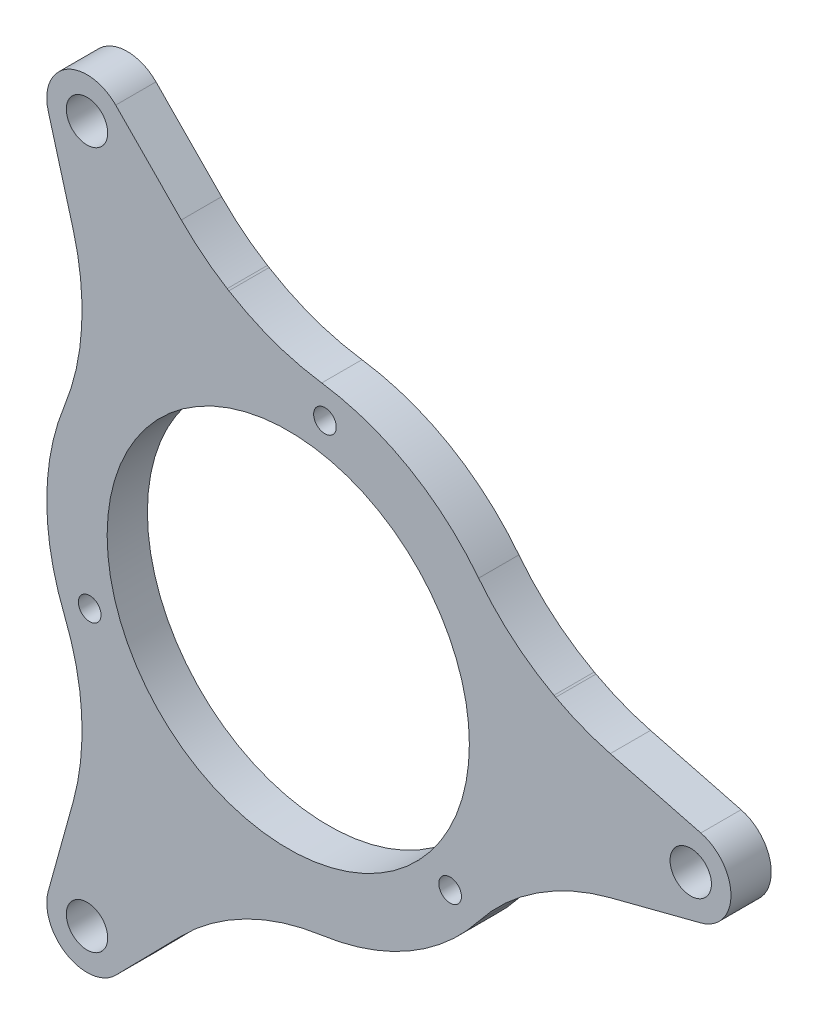
from build123d import *
from build123d.topology import SkipClean

# Parameters (mm, degrees)
BOSS_EXTRUDE1_DEPTH      = 6.35
BOSS_EXTRUDE1_DEPTH_BACK = 6.35
BOSS_EXTRUDE2_START      = -12.7
BOSS_EXTRUDE2_DEPTH      = 12.7
SKETCH4_R                = 28.575
CUT_EXTRUDE1_DEPTH       = 61.157662646
SKETCH5_R                = 28.575
BOSS_EXTRUDE3_DEPTH      = 6.35
F_0_257_DIAMETER_HOLE1_D = 6.5278
CUT_EXTRUDE2_DEPTH       = 94.825678832
CUT_EXTRUDE2_DEPTH_BACK  = 94.825678832
SKETCH8_W                = 12.7
SKETCH8_H                = 88.9
FILLET3_R                = 38.1
SKETCH10_R               = 1.786001
CUT_EXTRUDE4_DEPTH       = 94.17880933


with BuildPart() as part:
    # Sketch1 → Boss-Extrude1 (new, two sides: drawn at the far end of the back side and taken through both)
    with BuildSketch(Plane.XY.offset(-BOSS_EXTRUDE1_DEPTH_BACK)):
        with BuildLine():
            Line((27.49630657, 15.875), (38.494829198, 22.225))
            ThreePointArc((38.494829198, 22.225), (19.878280804, 29.537115412), (0, 31.75))
            Line((0, 31.75), (0, 44.45))
            ThreePointArc((0, 44.45), (-15.640751899, 31.983653865), (-27.49630657, 15.875))
            Line((-27.49630657, 15.875), (-38.494829198, 22.225))
            ThreePointArc((-38.494829198, 22.225), (-35.519032703, 2.446538454), (-27.49630657, -15.875))
            Line((-27.49630657, -15.875), (-38.494829198, -22.225))
            ThreePointArc((-38.494829198, -22.225), (-19.878280804, -29.537115412), (0, -31.75))
            Line((0, -31.75), (0, -44.45))
            ThreePointArc((0, -44.45), (15.640751899, -31.983653865), (27.49630657, -15.875))
            Line((27.49630657, -15.875), (38.494829198, -22.225))
            ThreePointArc((38.494829198, -22.225), (35.519032703, -2.446538454), (27.49630657, 15.875))
        make_face()
        with BuildLine():
            ThreePointArc((-11.129967969, 17.779280801), (-16.817028225, 8.924127912), (-20.962292819, -0.749194604))
            ThreePointArc((-20.962292819, -0.749194604), (-16.137035591, -10.101909703), (-9.83232485, -18.528475405))
            ThreePointArc((-9.83232485, -18.528475405), (0.679992634, -19.026037615), (11.129967969, -17.779280801))
            ThreePointArc((11.129967969, -17.779280801), (16.817028225, -8.924127912), (20.962292819, 0.749194604))
            ThreePointArc((20.962292819, 0.749194604), (16.137035591, 10.101909703), (9.83232485, 18.528475405))
            ThreePointArc((9.83232485, 18.528475405), (-0.679992634, 19.026037615), (-11.129967969, 17.779280801))
        make_face(mode=Mode.SUBTRACT)
    extrude(amount=BOSS_EXTRUDE1_DEPTH + BOSS_EXTRUDE1_DEPTH_BACK)

    # Sketch3 → Boss-Extrude2 (add)
    with BuildSketch(Plane.XY.offset(6.35).offset(BOSS_EXTRUDE2_START)):
        with BuildLine():
            ThreePointArc((-11.129967969, 17.779280801), (-16.817028225, 8.924127912), (-20.962292819, -0.749194604))
            ThreePointArc((-20.962292819, -0.749194604), (-16.137035591, -10.101909703), (-9.83232485, -18.528475405))
            ThreePointArc((-9.83232485, -18.528475405), (0.679992634, -19.026037615), (11.129967969, -17.779280801))
            ThreePointArc((11.129967969, -17.779280801), (16.817028225, -8.924127912), (20.962292819, 0.749194604))
            ThreePointArc((20.962292819, 0.749194604), (16.137035591, 10.101909703), (9.83232485, 18.528475405))
            ThreePointArc((9.83232485, 18.528475405), (-0.679992634, 19.026037615), (-11.129967969, 17.779280801))
        make_face()
    extrude(amount=BOSS_EXTRUDE2_DEPTH)

    # Sketch4 → Cut-Extrude1 (cut, through all)
    with BuildSketch(Plane.XY.offset(6.35)):
        Circle(SKETCH4_R)
    extrude(amount=-CUT_EXTRUDE1_DEPTH, mode=Mode.SUBTRACT)

    # Sketch5 → Boss-Extrude3 (add)
    with SkipClean():  # the faces are left unmerged after this step: merging them gives an invalid solid
        with BuildSketch(Plane(origin=(0, 0, -6.35), x_dir=(-1, 0, 0), z_dir=(0, 0, -1))):
            with BuildLine():
                Line((-46.293490064, -11.011328104), (-58.217602687, -7.926026976))
                Line((-58.217602687, -7.926026976), (-65.090673557, -6.147656209))
                ThreePointArc((-65.090673557, -6.147656209), (-69.850111749, 0), (-65.090673557, 6.147656209))
                Line((-65.090673557, 6.147656209), (-46.293490064, 11.011328104))
                Line((-46.293490064, 11.011328104), (-33.653938233, 17.861199328))
                ThreePointArc((-33.653938233, 17.861199328), (-19.05, 32.995567884), (1.358716756, 38.075765111))
                Line((1.358716756, 38.075765111), (13.610655164, 45.597002477))
                Line((13.610655164, 45.597002477), (27.221310328, 59.444004954))
                ThreePointArc((27.221310328, 59.444004954), (34.925055875, 60.491971232), (37.869363229, 53.296348745))
                Line((37.869363229, 53.296348745), (32.6828349, 34.585674373))
                Line((32.6828349, 34.585674373), (32.295221476, 20.214565783))
                ThreePointArc((32.295221476, 20.214565783), (38.1, 0), (32.295221476, -20.214565783))
                Line((32.295221476, -20.214565783), (32.6828349, -34.585674373))
                Line((32.6828349, -34.585674373), (37.869363229, -53.296348745))
                ThreePointArc((37.869363229, -53.296348745), (34.925055875, -60.491971232), (27.221310328, -59.444004954))
                Line((27.221310328, -59.444004954), (13.610655164, -45.597002477))
                Line((13.610655164, -45.597002477), (1.358716756, -38.075765111))
                ThreePointArc((1.358716756, -38.075765111), (-19.05, -32.995567884), (-33.653938233, -17.861199328))
                Line((-33.653938233, -17.861199328), (-46.293490064, -11.011328104))
            make_face()
            Circle(SKETCH5_R, mode=Mode.SUBTRACT)
        extrude(amount=BOSS_EXTRUDE3_DEPTH)

    # F (0.257) Diameter Hole1 (through all)
    with Locations(Plane.XY.offset(-6.35)):
        with Locations((-31.75, 54.99261314), (63.5, 0), (-31.75, -54.99261314), (0, 0)):
            Hole(F_0_257_DIAMETER_HOLE1_D / 2)

    # Sketch8 → Cut-Extrude2 (cut, two sides: drawn at the far end of the back side and taken through both)
    with BuildSketch(Plane(origin=(0, 0, 0), x_dir=(0, 0, -1), z_dir=(1, 0, 0)).offset(-CUT_EXTRUDE2_DEPTH_BACK)):
        Rectangle(SKETCH8_W, SKETCH8_H)
    extrude(amount=CUT_EXTRUDE2_DEPTH + CUT_EXTRUDE2_DEPTH_BACK, mode=Mode.SUBTRACT)

    # Fillet3
    fillet3_edges = [part.edges().sort_by_distance(p)[0] for p in [
        (-13.610655164, -45.597002477, -9.525),
        (-1.358716756, -38.075765111, -9.525),
        (33.653938233, -17.861199328, -9.525),
        (46.293490064, -11.011328104, -9.525),
        (46.293490064, 11.011328104, -9.525),
        (33.653938233, 17.861199328, -9.525),
        (-1.358716756, 38.075765111, -9.525),
        (-13.610655164, 45.597002477, -9.525),
        (-32.6828349, 34.585674373, -9.525),
        (-32.295221476, 20.214565783, -9.525),
        (-32.295221476, -20.214565783, -9.525),
        (-32.6828349, -34.585674373, -9.525),
    ]]
    fillet(fillet3_edges, radius=FILLET3_R)

    # Sketch10 → Cut-Extrude4 (cut, through all)
    with BuildSketch(Plane(origin=(0, 0, -12.7), x_dir=(-1, 0, 0), z_dir=(0, 0, -1))):
        with Locations((-5.788996123, 32.831028466)):
            Circle(SKETCH10_R)
        with Locations((31.327002745, -11.402096528)):
            Circle(SKETCH10_R)
        with Locations((-25.538006622, -21.428931938)):
            Circle(SKETCH10_R)
    extrude(amount=-CUT_EXTRUDE4_DEPTH, mode=Mode.SUBTRACT)


solid = part.part
